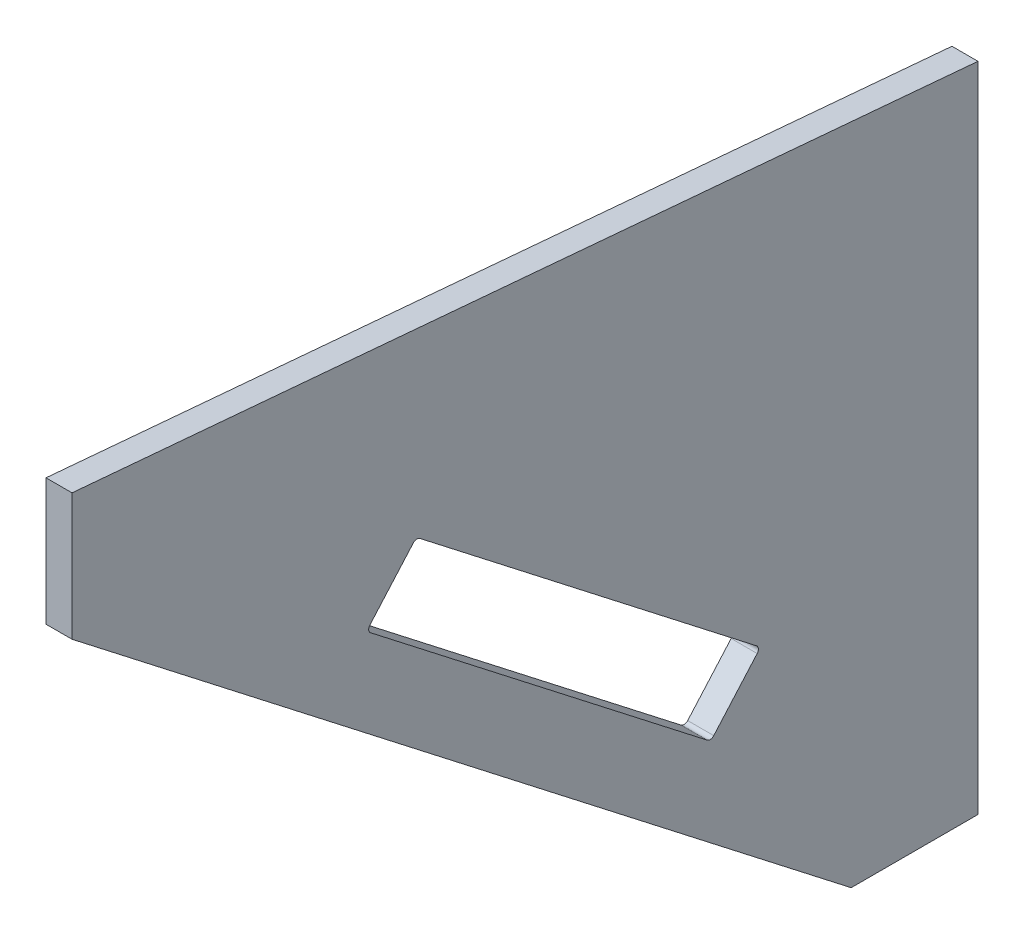
from build123d import *

# Parameters (mm, degrees)
BOSS_EXTRUDE1_DEPTH = 18.25625
CUT_EXTRUDE1_DEPTH  = 783.681372376
FILLET1_R           = 3.3782


with BuildPart() as part:
    # Sketch1 → Boss-Extrude1 (new body)
    with BuildSketch(Plane(origin=(0, 0, 0), x_dir=(0, 0, -1), z_dir=(1, 0, 0))):
        Polygon((0, 0), (-635, 55.555301339), (-635, -33.3375), (-88.9, -457.2), (0, -457.2), align=None)
    extrude(amount=BOSS_EXTRUDE1_DEPTH)

    # Sketch3 → Cut-Extrude1 (cut, through all)
    with BuildSketch(Plane.ZY):
        Polygon((428.625, -131.7625), (187.325, -319.0875), (152.4, -279.4), (393.7, -92.075), align=None)
    extrude(amount=-CUT_EXTRUDE1_DEPTH, mode=Mode.SUBTRACT)

    # Fillet1
    fillet1_edges = [part.edges().sort_by_distance(p)[0] for p in [
        (9.128125, -319.0875, 187.325),
        (9.128125, -279.4, 152.4),
        (9.128125, -92.075, 393.7),
        (9.128125, -131.7625, 428.625),
    ]]
    fillet(fillet1_edges, radius=FILLET1_R)


solid = part.part
